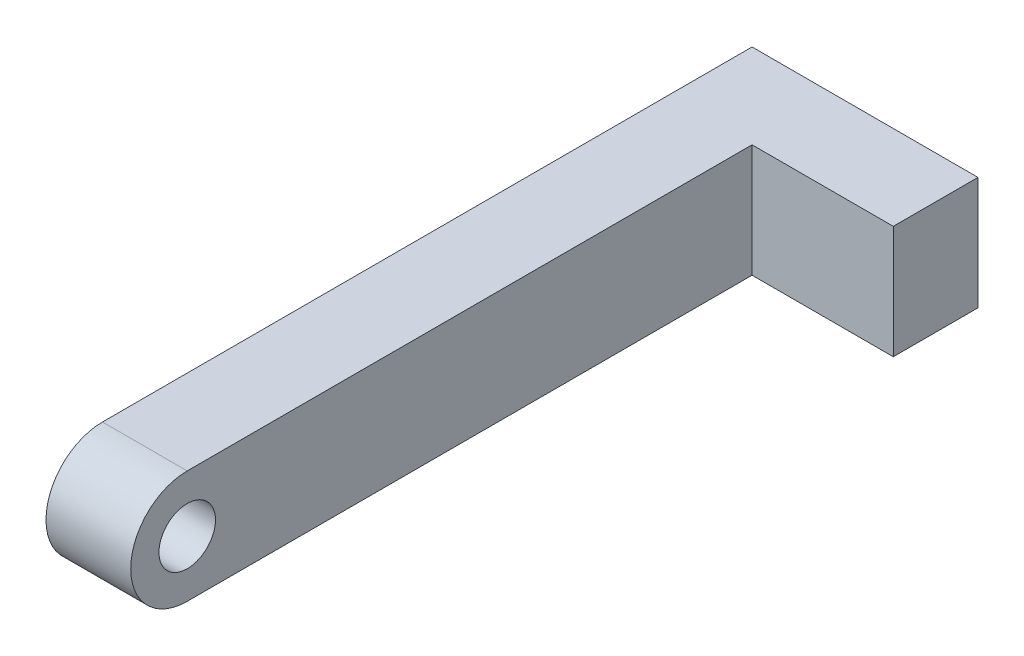
from build123d import *

# Parameters (mm, degrees)
SZKIC1_R                    = 4
SZKIC1_R_2                  = 2
DODANIE_WYCI_GNI_CIE1_DEPTH = 6
SZKIC2_W                    = 6
SZKIC2_H                    = 8
DODANIE_WYCI_GNI_CIE2_DEPTH = 10


with BuildPart() as part:
    # Szkic1 → Dodanie-wyciągnięcie1 (new body)
    # profile 1 of 2: a face of its own
    with BuildSketch(Plane(origin=(0, 0, 0), x_dir=(0, 0, -1), z_dir=(1, 0, 0))):
        with BuildLine():
            Line((46, 4), (0, 4))
            ThreePointArc((0, 4), (2.828427125, 2.828427125), (4, 0))
            ThreePointArc((4, 0), (2.828427125, -2.828427125), (0, -4))
            Line((0, -4), (46, -4))
            Line((46, -4), (46, 4))
        make_face()
    # profile 2 of 2: a face of its own
    with BuildSketch(Plane(origin=(0, 0, 0), x_dir=(0, 0, -1), z_dir=(1, 0, 0))):
        Circle(SZKIC1_R)
        Circle(SZKIC1_R_2, mode=Mode.SUBTRACT)
    extrude(amount=DODANIE_WYCI_GNI_CIE1_DEPTH)

    # Szkic2 → Dodanie-wyciągnięcie2 (add)
    with BuildSketch(Plane(origin=(6, 0, 0), x_dir=(0, 0, -1), z_dir=(1, 0, 0))):
        with Locations((43, 0)):
            Rectangle(SZKIC2_W, SZKIC2_H)
    extrude(amount=DODANIE_WYCI_GNI_CIE2_DEPTH)


solid = part.part
